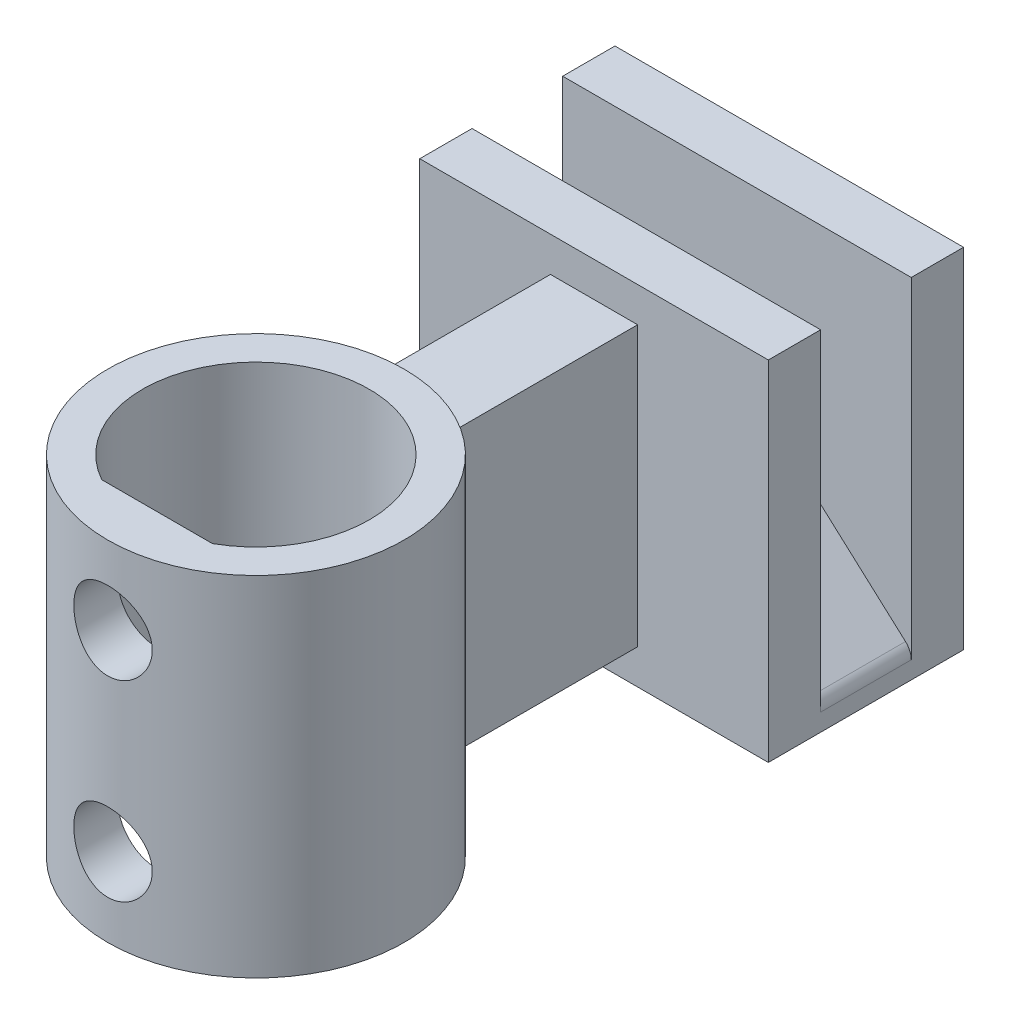
from build123d import *

# Parameters (mm, degrees)
SKETCH2_W                       = 20
SKETCH2_H                       = 10
BOSS_EXTRUDE1_DEPTH             = 2.6
CHAMFER1_SIZE                   = 9.5
CHAMFER1_SIZE2                  = 8.553838421
FILLET3_R                       = 1
SKETCH3_W                       = 20
SKETCH3_H                       = 20
BOSS_EXTRUDE2_DEPTH             = 3
BOSS_EXTRUDE3_REACH             = 20.877
SKETCH6_R                       = 8.5
BOSS_EXTRUDE3_DIRECTION_2_REACH = 20.877
BOSS_EXTRUDE4_REACH             = 35.218
BOSS_EXTRUDE4_END_RADIUS        = 8.5
SKETCH5_W                       = 5
SKETCH5_H                       = 16
CUT_EXTRUDE1_REACH              = 33.311
CUT_EXTRUDE1_END_RADIUS         = 8.5
SKETCH7_R                       = 2.25


with BuildPart() as part:
    # Sketch2 → Boss-Extrude1 (new, symmetric)
    with BuildSketch(Plane.XY):
        Rectangle(SKETCH2_W, SKETCH2_H)
    extrude(amount=BOSS_EXTRUDE1_DEPTH, both=True)

    # Chamfer1
    chamfer1_edges = [part.edges().sort_by_distance(p)[0] for p in [
        (-10, 5, 0),
        (10, 5, 0),
    ]]
    chamfer1_side = [part.faces().sort_by_distance(p)[0] for p in [
        (0, 5, 0),
    ]]
    chamfer(chamfer1_edges, length=CHAMFER1_SIZE, length2=CHAMFER1_SIZE2, reference=chamfer1_side[0])

    # Fillet3
    fillet3_edges = [part.edges().sort_by_distance(p)[0] for p in [
        (-0.5, 5, 0),
        (0.5, 5, 0),
        (10, -3.553838421, 0),
        (-10, -3.553838421, 0),
    ]]
    fillet(fillet3_edges, radius=FILLET3_R)

    # Sketch3 → Boss-Extrude2 (add)
    with BuildSketch(Plane.XY.offset(2.6)):
        with Locations((0, 5)):
            Rectangle(SKETCH3_W, SKETCH3_H)
    boss_extrude2 = extrude(amount=BOSS_EXTRUDE2_DEPTH)

    # Mirror1: Boss-Extrude2 across plane
    add(boss_extrude2.mirror(Plane.XY))


with BuildPart() as body_2:

    # Boss-Extrude3: up to this face of the body (flat: up to its plane)
    boss_extrude3_end = Plane(part.part.faces().sort_by_distance((0, 15, 4.1))[0])
    # Sketch6 → Boss-Extrude3 (new, up to the picked face)
    with BuildSketch(Plane(origin=(0, 0, 0), x_dir=(1, 0, 0), z_dir=(0, 1, 0)), mode=Mode.PRIVATE) as boss_extrude3_sk1:
        with Locations(Location((0, -25, 0), (0, 0, 90))):
            Circle(SKETCH6_R)
        with BuildLine():
            Line((3.175, -30.671805268), (-3.175, -30.671805268))
            ThreePointArc((-3.175, -30.671805268), (0, -18.5), (3.175, -30.671805268))
        make_face(mode=Mode.SUBTRACT)
    boss_extrude3_tool1 = split(extrude(boss_extrude3_sk1.sketch, amount=BOSS_EXTRUDE3_REACH, mode=Mode.PRIVATE), bisect_by=boss_extrude3_end, keep=Keep.BOTH, mode=Mode.PRIVATE)
    add(boss_extrude3_tool1.solids().sort_by(Axis((0, 0, 33.259584), (0, 1, 0)))[0])


    # Boss-Extrude3 direction 2: up to this face of the body (flat: up to its plane)
    boss_extrude3_direction_2_end = Plane(part.part.faces().sort_by_distance((0, -5, 0))[0])
    # Sketch6 → Boss-Extrude3 direction 2 (add, up to the picked face)
    with BuildSketch(Plane(origin=(0, 0, 0), x_dir=(1, 0, 0), z_dir=(0, 1, 0)), mode=Mode.PRIVATE) as boss_extrude3_direction_2_sk1:
        with Locations(Location((0, -25, 0), (0, 0, 90))):
            Circle(SKETCH6_R)
        with BuildLine():
            Line((3.175, -30.671805268), (-3.175, -30.671805268))
            ThreePointArc((-3.175, -30.671805268), (0, -18.5), (3.175, -30.671805268))
        make_face(mode=Mode.SUBTRACT)
    boss_extrude3_direction_2_tool1 = split(extrude(boss_extrude3_direction_2_sk1.sketch, amount=-BOSS_EXTRUDE3_DIRECTION_2_REACH, mode=Mode.PRIVATE), bisect_by=boss_extrude3_direction_2_end, keep=Keep.BOTH, mode=Mode.PRIVATE)
    add(boss_extrude3_direction_2_tool1.solids().sort_by(Axis((0, 0, 33.259584), (0, -1, 0)))[0])


with BuildPart() as part_1:
    add(part.part)

    add(body_2.part)  # Boss-Extrude4 merges body 2
    # Boss-Extrude4: up to this cylinder (the profile starts outside it)
    boss_extrude4_end = Plane(origin=(0, 5, 25), z_dir=(0, -1, 0)) * Cylinder(BOSS_EXTRUDE4_END_RADIUS, 88.436, mode=Mode.PRIVATE)
    # Sketch5 → Boss-Extrude4 (add, up to the surface)
    with BuildSketch(Plane.XY.offset(5.6), mode=Mode.PRIVATE) as boss_extrude4_sk1:
        with Locations((0, 5)):
            Rectangle(SKETCH5_W, SKETCH5_H)
    boss_extrude4_tool1 = extrude(boss_extrude4_sk1.sketch, amount=BOSS_EXTRUDE4_REACH, mode=Mode.PRIVATE) - boss_extrude4_end
    add(boss_extrude4_tool1.solids().sort_by_distance((0, 5, 5.6))[0])

    # Cut-Extrude1: up to this cylinder (the profile starts inside it)
    cut_extrude1_end = Plane(origin=(0, 5, 25), z_dir=(0, -1, 0)) * Cylinder(CUT_EXTRUDE1_END_RADIUS, 95.622, mode=Mode.PRIVATE)
    # Sketch7 → Cut-Extrude1 (cut, up to the surface)
    with BuildSketch(Plane.XY.offset(20), mode=Mode.PRIVATE) as cut_extrude1_sk1:
        with Locations(Location((0, 10.5, 0), (0, 0, 180))):
            Circle(SKETCH7_R)
    cut_extrude1_tool1 = extrude(cut_extrude1_sk1.sketch, amount=CUT_EXTRUDE1_REACH, mode=Mode.PRIVATE) & cut_extrude1_end
    add(cut_extrude1_tool1.solids().sort_by_distance((0, 10.5, 20))[0], mode=Mode.SUBTRACT)
    # Sketch7 → Cut-Extrude1 (cut, up to the surface)
    with BuildSketch(Plane.XY.offset(20), mode=Mode.PRIVATE) as cut_extrude1_sk2:
        with Locations(Location((0, -0.5, 0), (0, 0, 180))):
            Circle(SKETCH7_R)
    cut_extrude1_tool2 = extrude(cut_extrude1_sk2.sketch, amount=CUT_EXTRUDE1_REACH, mode=Mode.PRIVATE) & cut_extrude1_end
    add(cut_extrude1_tool2.solids().sort_by_distance((0, -0.5, 20))[0], mode=Mode.SUBTRACT)


solid = part_1.part
